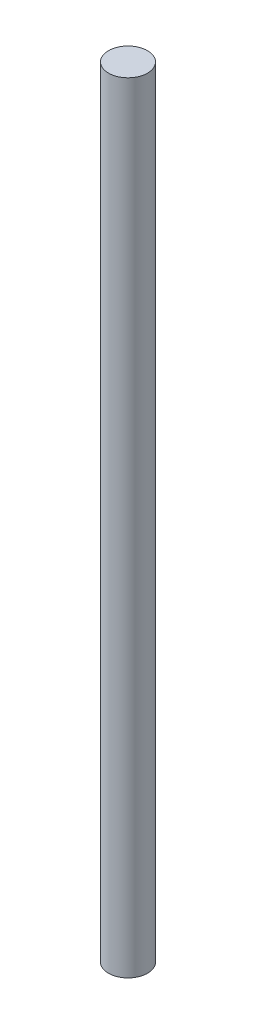
from build123d import *

# Parameters (mm, degrees)
SKETCH1_R           = 7.62
BOSS_EXTRUDE1_DEPTH = 304.8


with BuildPart() as part:
    # Sketch1 → Boss-Extrude1 (new body)
    with BuildSketch(Plane(origin=(0, 0, 0), x_dir=(1, 0, 0), z_dir=(0, 1, 0))):
        with Locations(Location((0, 0, 0), (0, 0, 90))):
            Circle(SKETCH1_R)
    extrude(amount=BOSS_EXTRUDE1_DEPTH)


solid = part.part
